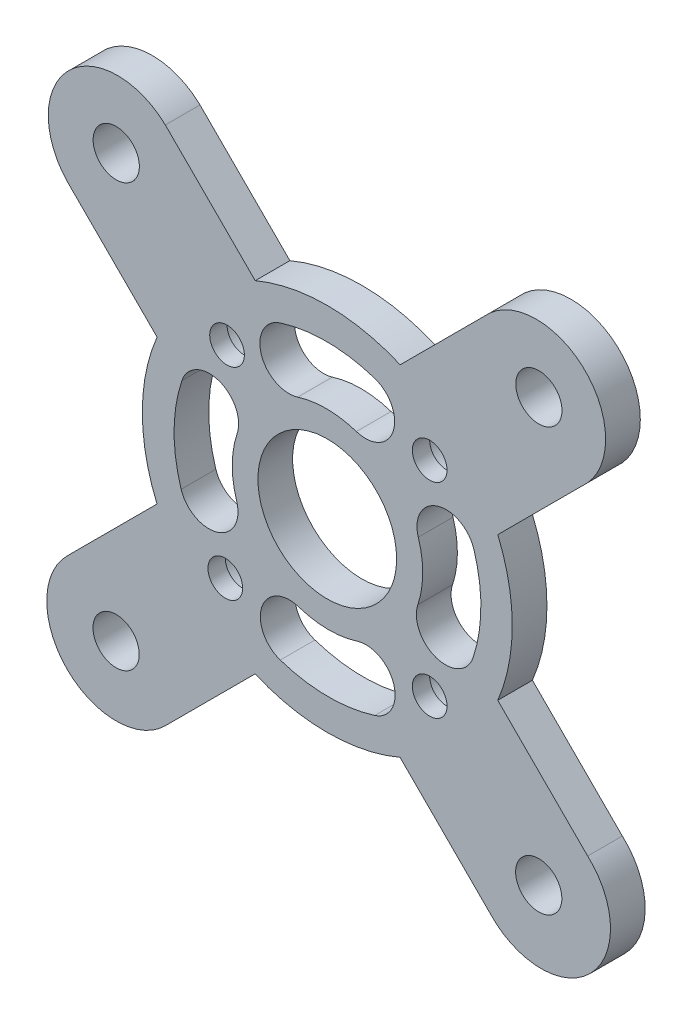
from build123d import *

# Parameters (mm, degrees)
ESBO_O1_R                                            = 6
RESSALTO_EXTRUS_O1_DEPTH                             = 3
REBAIXO_PARA_PARAFUSO_DE_M_QUINA_COM_CAB_D           = 3
REBAIXO_PARA_PARAFUSO_DE_M_QUINA_COM_CAB_CBORE_D     = 5
REBAIXO_PARA_PARAFUSO_DE_M_QUINA_COM_CAB_CBORE_DEPTH = 1.5
ESBO_O3_R                                            = 2
CORTE_EXTRUS_O1_DEPTH                                = 35.715241483


with BuildPart() as part:
    # Esboço1 → Ressalto-extrusão1 (new body)
    with BuildSketch(Plane.XY):
        with BuildLine():
            Line((22.509738768, 13.987877111), (14.731564175, 6.209702518))
            ThreePointArc((14.731564175, 6.209702518), (15.982587719, 0.002329667), (14.727577793, -6.204238442))
            Line((14.727577793, -6.204238442), (22.505752386, -13.982413035))
            ThreePointArc((22.505752386, -13.982413035), (22.734084307, -22.662243955), (14.053133017, -22.48145412))
            Line((14.053133017, -22.48145412), (6.274958424, -14.703279527))
            ThreePointArc((6.274958424, -14.703279527), (0.008088366, -15.99251207), (-6.26285925, -14.723261559))
            Line((-6.26285925, -14.723261559), (-14.041033843, -22.501436152))
            ThreePointArc((-14.041033843, -22.501436152), (-22.526315217, -22.501436152), (-22.526315217, -14.016154778))
            Line((-22.526315217, -14.016154778), (-14.748140624, -6.237980185))
            ThreePointArc((-14.748140624, -6.237980185), (-16.017408692, 0.016872321), (-14.740788367, 6.270228368))
            Line((-14.740788367, 6.270228368), (-22.51896296, 14.048402961))
            ThreePointArc((-22.51896296, 14.048402961), (-22.390928385, 22.410501827), (-14.028587912, 22.521641923))
            Line((-14.028587912, 22.521641923), (-6.250413319, 14.74346733))
            ThreePointArc((-6.250413319, 14.74346733), (0.022005702, 16.007419056), (6.288120931, 14.712577651))
            Line((6.288120931, 14.712577651), (14.066295524, 22.490752244))
            ThreePointArc((14.066295524, 22.490752244), (22.318505349, 22.241631288), (22.509738768, 13.987877111))
        make_face()
        with Locations((-0.017411456, 0.007467609)):
            Circle(ESBO_O1_R, mode=Mode.SUBTRACT)
        with BuildLine():
            ThreePointArc((4.084918003, 12.594218492), (0.002992983, 13.270918226), (-4.088943192, 12.657654219))
            ThreePointArc((-4.088943192, 12.657654219), (-5.733074845, 9.500414621), (-2.575835247, 7.856282968))
            ThreePointArc((-2.575835247, 7.856282968), (-0.036074884, 8.236920288), (2.497471811, 7.816910031))
            ThreePointArc((2.497471811, 7.816910031), (5.679849137, 9.411841166), (4.084918003, 12.594218492))
        make_face(mode=Mode.SUBTRACT)
        with BuildLine():
            ThreePointArc((12.594218492, -4.084918003), (13.270918226, -0.002992983), (12.657654219, 4.088943192))
            ThreePointArc((12.657654219, 4.088943192), (9.500414621, 5.733074845), (7.856282968, 2.575835247))
            ThreePointArc((7.856282968, 2.575835247), (8.236920288, 0.036074884), (7.816910031, -2.497471811))
            ThreePointArc((7.816910031, -2.497471811), (9.411841166, -5.679849137), (12.594218492, -4.084918003))
        make_face(mode=Mode.SUBTRACT)
        with BuildLine():
            ThreePointArc((-4.084918003, -12.594218492), (-0.002992983, -13.270918226), (4.088943192, -12.657654219))
            ThreePointArc((4.088943192, -12.657654219), (5.733074845, -9.500414621), (2.575835247, -7.856282968))
            ThreePointArc((2.575835247, -7.856282968), (0.036074884, -8.236920288), (-2.497471811, -7.816910031))
            ThreePointArc((-2.497471811, -7.816910031), (-5.679849137, -9.411841166), (-4.084918003, -12.594218492))
        make_face(mode=Mode.SUBTRACT)
        with BuildLine():
            ThreePointArc((-12.594218492, 4.084918003), (-13.270918226, 0.002992983), (-12.657654219, -4.088943192))
            ThreePointArc((-12.657654219, -4.088943192), (-9.500414621, -5.733074845), (-7.856282968, -2.575835247))
            ThreePointArc((-7.856282968, -2.575835247), (-8.236920288, -0.036074884), (-7.816910031, 2.497471811))
            ThreePointArc((-7.816910031, 2.497471811), (-9.411841166, 5.679849137), (-12.594218492, 4.084918003))
        make_face(mode=Mode.SUBTRACT)
    extrude(amount=RESSALTO_EXTRUS_O1_DEPTH)

    # Rebaixo para parafuso de máquina com cabeça panela de M22 (through all)
    with Locations(Plane(origin=(8.838834765, 8.838834765, 0), x_dir=(-1, 0, 0), z_dir=(0, 0, -1))):
        with Locations((0, 0), (17.528411311, -0.138256325), (17.67766953, -17.67766953), (0, -17.67766953)):
            CounterBoreHole(REBAIXO_PARA_PARAFUSO_DE_M_QUINA_COM_CAB_D / 2, REBAIXO_PARA_PARAFUSO_DE_M_QUINA_COM_CAB_CBORE_D / 2, REBAIXO_PARA_PARAFUSO_DE_M_QUINA_COM_CAB_CBORE_DEPTH)

    # Esboço3 → Corte-extrusão1 (cut, through all)
    with BuildSketch(Plane(origin=(0, 0, 0), x_dir=(-1, 0, 0), z_dir=(0, 0, -1))):
        with Locations((-18.285022442, 18.273775436)):
            Circle(ESBO_O3_R)
        with Locations((18.273775436, 18.285022442)):
            Circle(ESBO_O3_R)
        with Locations((18.285022442, -18.273775436)):
            Circle(ESBO_O3_R)
        with Locations((-18.273775436, -18.285022442)):
            Circle(ESBO_O3_R)
    extrude(amount=-CORTE_EXTRUS_O1_DEPTH, mode=Mode.SUBTRACT)


solid = part.part
